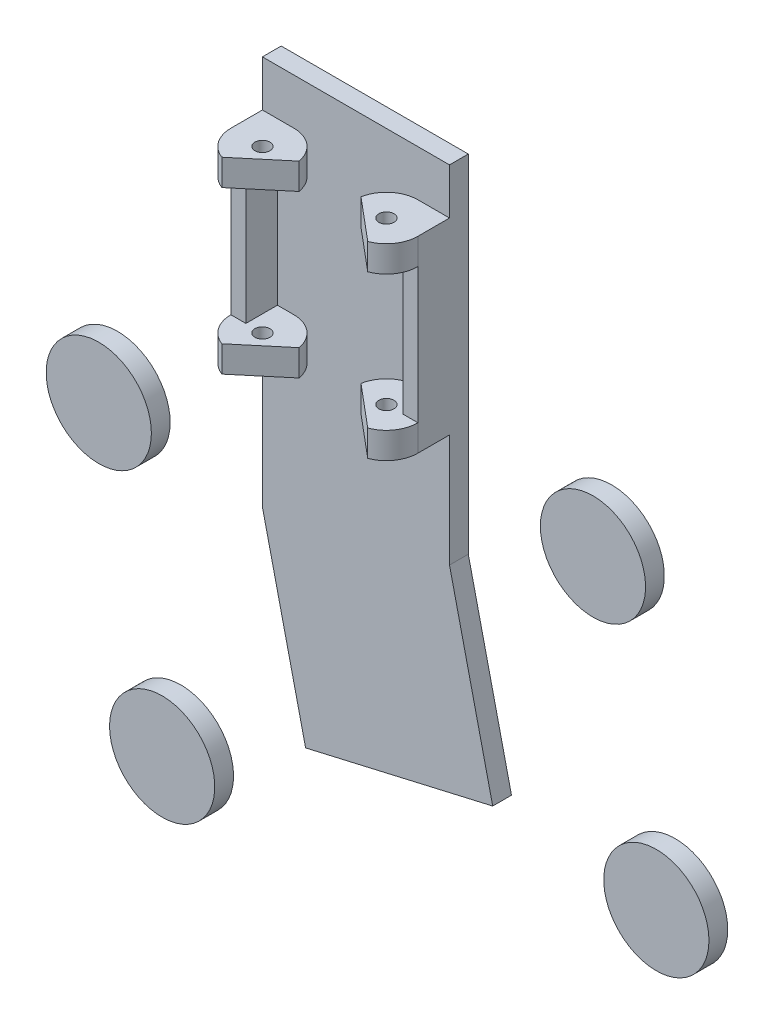
from build123d import *

# Parameters (mm, degrees)
BOSS_EXTRUDE2_DEPTH     = 7
CUT_EXTRUDE2_DEPTH      = 30.130224853
CUT_EXTRUDE2_DEPTH_BACK = 30.130224853
SKETCH3_R               = 2
BOSS_EXTRUDE3_DEPTH     = 36
SKETCH5_R               = 2
BOSS_EXTRUDE4_DEPTH     = 7
SKETCH13_W              = 49.8
SKETCH13_H              = 5
BOSS_EXTRUDE6_DEPTH     = 12.25
SKETCH15_W              = 49.8
SKETCH15_H              = 5
BOSS_EXTRUDE7_DEPTH     = 30
SKETCH12_R              = 14
BOSS_EXTRUDE8_DEPTH     = 5


with BuildPart() as part:
    # Sketch1 → Boss-Extrude2 (new body)
    with BuildSketch(Plane(origin=(0, 0, 0), x_dir=(1, 0, 0), z_dir=(0, 1, 0))):
        with BuildLine():
            Line((-24.9, 0), (-24.9, 13.4))
            Line((-24.9, 13.4), (24.9, 13.4))
            Line((24.9, 13.4), (24.9, 0))
            ThreePointArc((24.9, 0), (23.392904185, -4.800819919), (19.412411454, -7.878950407))
            Line((19.412411454, -7.878950407), (8.235013612, 1.5))
            ThreePointArc((8.235013612, 1.5), (11.116692467, 6.448255578), (16.5, 8.4))
            Line((16.5, 8.4), (-16.5, 8.4))
            ThreePointArc((-16.5, 8.4), (-11.116692467, 6.448255578), (-8.235013612, 1.5))
            Line((-8.235013612, 1.5), (-19.412411454, -7.878950407))
            ThreePointArc((-19.412411454, -7.878950407), (-23.392904185, -4.800819919), (-24.9, 0))
        make_face()
    extrude(amount=BOSS_EXTRUDE2_DEPTH)

    # Sketch3 → Cut-Extrude2 (cut, two sides: drawn at the far end of the back side and taken through both)
    with BuildSketch(Plane(origin=(0, 7, 0), x_dir=(1, 0, 0), z_dir=(0, 1, 0)).offset(-CUT_EXTRUDE2_DEPTH_BACK)):
        with Locations(Location((-16.5, 0, 0), (0, 0, 270))):
            Circle(SKETCH3_R)
        with Locations(Location((16.5, 0, 0), (0, 0, 270))):
            Circle(SKETCH3_R)
    extrude(amount=CUT_EXTRUDE2_DEPTH + CUT_EXTRUDE2_DEPTH_BACK, mode=Mode.SUBTRACT)

    # Sketch4 → Boss-Extrude3 (add)
    with BuildSketch(Plane(origin=(0, 7, 0), x_dir=(1, 0, 0), z_dir=(0, 1, 0))):
        Polygon((-24.9, 13.4), (-24.9, 0), (-20.9, 0), (-20.9, 8.4), (-16.5, 8.4), (16.5, 8.4), (20.9, 8.4), (20.9, 0), (24.9, 0), (24.9, 13.4), align=None)
    extrude(amount=BOSS_EXTRUDE3_DEPTH)

    # Sketch5 → Boss-Extrude4 (add)
    with BuildSketch(Plane(origin=(0, 43, 0), x_dir=(1, 0, 0), z_dir=(0, 1, 0))):
        with BuildLine():
            Line((-24.9, 13.4), (-24.9, 0))
            ThreePointArc((-24.9, 0), (-23.392904185, -4.800819919), (-19.412411454, -7.878950407))
            Line((-19.412411454, -7.878950407), (-8.235013612, 1.5))
            ThreePointArc((-8.235013612, 1.5), (-11.116692467, 6.448255578), (-16.5, 8.4))
            Line((-16.5, 8.4), (16.5, 8.4))
            ThreePointArc((16.5, 8.4), (11.116692467, 6.448255578), (8.235013612, 1.5))
            Line((8.235013612, 1.5), (19.412411454, -7.878950407))
            ThreePointArc((19.412411454, -7.878950407), (23.392904185, -4.800819919), (24.9, 0))
            Line((24.9, 0), (24.9, 13.4))
            Line((24.9, 13.4), (-24.9, 13.4))
        make_face()
        with Locations(Location((16.5, 0, 0), (0, 0, 270))):
            Circle(SKETCH5_R, mode=Mode.SUBTRACT)
        with Locations(Location((-16.5, 0, 0), (0, 0, 270))):
            Circle(SKETCH5_R, mode=Mode.SUBTRACT)
    extrude(amount=BOSS_EXTRUDE4_DEPTH)

    # Sketch13 → Boss-Extrude6 (add)
    with BuildSketch(Plane(origin=(0, 50, 0), x_dir=(1, 0, 0), z_dir=(0, 1, 0))):
        with Locations((0, 10.9)):
            Rectangle(SKETCH13_W, SKETCH13_H)
    extrude(amount=BOSS_EXTRUDE6_DEPTH)

    # Sketch15 → Boss-Extrude7 (add)
    with BuildSketch(Plane.XZ):
        with Locations((0, -10.9)):
            Rectangle(SKETCH15_W, SKETCH15_H)
    extrude(amount=BOSS_EXTRUDE7_DEPTH)

    # Sketch12 → Boss-Extrude8 (add)
    with BuildSketch(Plane(origin=(0, 0, -13.4), x_dir=(-1, 0, 0), z_dir=(0, 0, -1))):
        with Locations((-63.082932794, -8.925544361)):
            Circle(SKETCH12_R)
        with Locations(Location((-79.95426187, -82.00329922, 0), (0, 0, 180))):
            Circle(SKETCH12_R)
        with Locations(Location((68.457025952, -39.293936698, 0), (0, 0, 180))):
            Circle(SKETCH12_R)
        with Locations((51.585696876, -112.371691557)):
            Circle(SKETCH12_R)
        Polygon((-24.9, -30), (-36.397235918, -79.8), (13.402764082, -91.297235918), (24.9, -41.497235918), (24.9, -30), align=None)
    extrude(amount=-BOSS_EXTRUDE8_DEPTH)


with BuildPart() as boss_extrude8_piece_1:
    # of the separate pieces the step leaves, piece 1, a body of its own (boss_extrude8_pieces)
    add(part.part.solids().sort_by_distance((-8.235013612, 0, -1.5))[0])


with BuildPart() as boss_extrude8_piece_2:
    # of the separate pieces the step leaves, piece 2, a body of its own (boss_extrude8_pieces)
    add(part.part.solids().sort_by_distance((-65.585696876, -112.371691557, -13.4))[0])


with BuildPart() as boss_extrude8_piece_3:
    # of the separate pieces the step leaves, piece 3, a body of its own (boss_extrude8_pieces)
    add(part.part.solids().sort_by_distance((93.95426187, -82.00329922, -13.4))[0])


with BuildPart() as boss_extrude8_piece_4:
    # of the separate pieces the step leaves, piece 4, a body of its own (boss_extrude8_pieces)
    add(part.part.solids().sort_by_distance((-54.457025952, -39.293936698, -13.4))[0])


with BuildPart() as boss_extrude8_piece_5:
    # of the separate pieces the step leaves, piece 5, a body of its own (boss_extrude8_pieces)
    add(part.part.solids().sort_by_distance((49.082932794, -8.925544361, -13.4))[0])


solid = Compound([boss_extrude8_piece_1.part, boss_extrude8_piece_2.part, boss_extrude8_piece_3.part, boss_extrude8_piece_4.part, boss_extrude8_piece_5.part])
